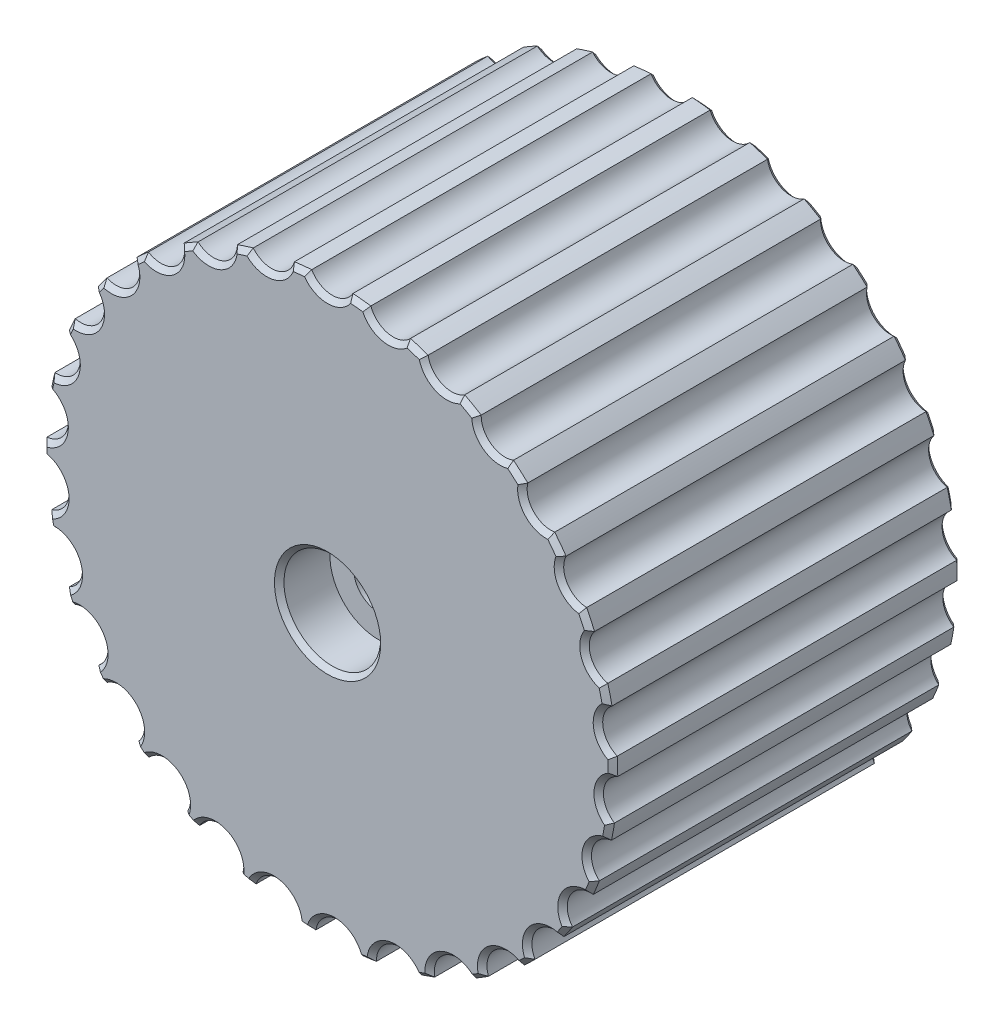
from build123d import *

# Parameters (mm, degrees)
SKIZZE1_R                       = 18
GRUNDK_RPER_DEPTH               = 14
SKIZZE3_R                       = 11.05
SITZ_KUGELLAGER_DEPTH           = 7.5
SITZ_SCHNECKENGEH_USE_START     = 8
SKIZZE4_R                       = 18
SKIZZE4_R_2                     = 15.6
SITZ_SCHNECKENGEH_USE_DEPTH     = 8
SKIZZE5_R                       = 1.55
BOHRUNG_M3_ZAPFEN_DEPTH         = 34.645207683
SKIZZE6_R                       = 3.05
SENKUNG_M3_DEPTH                = 3.2
SKIZZE7_R                       = 1.5
SCHNITT_LINEAR_AUSTRAGEN3_DEPTH = 34.645207683
FASE1_SIZE                      = 0.3
FREISCHNITTKUGELLAGER_DEPTH     = 7.5
FASE2_SIZE                      = 0.4


with BuildPart() as part:
    # Skizze1 → Grundkörper (new body)
    with BuildSketch(Plane.XY):
        Circle(SKIZZE1_R)
    extrude(amount=GRUNDK_RPER_DEPTH)

    # Skizze3 → Sitz_Kugellager (cut)
    with BuildSketch(Plane(origin=(0, 0, 0), x_dir=(-1, 0, 0), z_dir=(0, 0, -1))):
        Circle(SKIZZE3_R)
    extrude(amount=-SITZ_KUGELLAGER_DEPTH, mode=Mode.SUBTRACT)

    # Skizze4 → Sitz_SchneckenGehäuse (add)
    with BuildSketch(Plane(origin=(0, 0, 0), x_dir=(-1, 0, 0), z_dir=(0, 0, -1)).offset(SITZ_SCHNECKENGEH_USE_START)):
        Circle(SKIZZE4_R)
        Circle(SKIZZE4_R_2, mode=Mode.SUBTRACT)
    extrude(amount=-SITZ_SCHNECKENGEH_USE_DEPTH)

    # Skizze5 → Bohrung M3 Zapfen (cut, through all)
    with BuildSketch(Plane.XY.offset(14)):
        Circle(SKIZZE5_R)
    extrude(amount=-BOHRUNG_M3_ZAPFEN_DEPTH, mode=Mode.SUBTRACT)

    # Skizze6 → Senkung M3 (cut)
    with BuildSketch(Plane.XY.offset(14)):
        Circle(SKIZZE6_R)
    extrude(amount=-SENKUNG_M3_DEPTH, mode=Mode.SUBTRACT)

    # Skizze7 → Schnitt-Linear austragen3 (cut, through all)
    with BuildSketch(Plane.XY.offset(14)):
        with Locations((0, 18.7)):
            Circle(SKIZZE7_R)
        with Locations((3.840889693, 18.343624365)):
            Circle(SKIZZE7_R)
        with Locations((7.52375207, 17.196470523)):
            Circle(SKIZZE7_R)
        with Locations((10.887628372, 15.308674601)):
            Circle(SKIZZE7_R)
        with Locations((13.785501065, 12.762742339)):
            Circle(SKIZZE7_R)
        with Locations((16.090719205, 9.669943194)):
            Circle(SKIZZE7_R)
        with Locations((17.702533699, 6.16544733)):
            Circle(SKIZZE7_R)
        with Locations((18.550500518, 2.402418031)):
            Circle(SKIZZE7_R)
        with Locations((18.597559443, -1.454682263)):
            Circle(SKIZZE7_R)
        with Locations((17.841653775, -5.237279763)):
            Circle(SKIZZE7_R)
        with Locations((16.315820216, -8.780056806)):
            Circle(SKIZZE7_R)
        with Locations((14.086745017, -11.928177036)):
            Circle(SKIZZE7_R)
        with Locations((11.251849459, -14.544052492)):
            Circle(SKIZZE7_R)
        with Locations((7.935032082, -16.513356864)):
            Circle(SKIZZE7_R)
        with Locations((4.281253721, -17.750022102)):
            Circle(SKIZZE7_R)
        with Locations((0.450202022, -18.2)):
            Circle(SKIZZE7_R)
        with Locations((-3.390687671, -17.843624365)):
            Circle(SKIZZE7_R)
        with Locations((-7.073550047, -16.696470523)):
            Circle(SKIZZE7_R)
        with Locations((-10.43742635, -14.808674601)):
            Circle(SKIZZE7_R)
        with Locations((-13.335299043, -12.262742339)):
            Circle(SKIZZE7_R)
        with Locations((-15.640517183, -9.169943194)):
            Circle(SKIZZE7_R)
        with Locations((-17.252331677, -5.66544733)):
            Circle(SKIZZE7_R)
        with Locations((-18.100298496, -1.902418031)):
            Circle(SKIZZE7_R)
        with Locations((-18.147357421, 1.954682263)):
            Circle(SKIZZE7_R)
        with Locations((-17.391451752, 5.737279763)):
            Circle(SKIZZE7_R)
        with Locations((-15.865618194, 9.280056806)):
            Circle(SKIZZE7_R)
        with Locations((-13.636542995, 12.428177036)):
            Circle(SKIZZE7_R)
        with Locations((-10.801647437, 15.044052492)):
            Circle(SKIZZE7_R)
        with Locations((-7.48483006, 17.013356864)):
            Circle(SKIZZE7_R)
        with Locations((-3.831051698, 18.250022102)):
            Circle(SKIZZE7_R)
    extrude(amount=-SCHNITT_LINEAR_AUSTRAGEN3_DEPTH, mode=Mode.SUBTRACT)

    # Fase1
    fase1_edges = [part.edges().sort_by_distance(p)[0] for p in [
        (15.6, 0, -8),
        (17.102127152, -1.337711064, -8),
        (17.102127152, -1.337711064, 14),
        (16.402381555, -4.814792511, -8),
        (16.402381555, -4.814792511, 14),
        (14.994931633, -8.069245051, -8),
        (14.994931633, -8.069245051, 14),
        (12.942011218, -10.958855351, -8),
        (12.942011218, -10.958855351, 14),
        (10.33400092, -13.357648657, -8),
        (10.33400092, -13.357648657, 14),
        (7.285361892, -15.16134775, -8),
        (7.285361892, -15.16134775, 14),
        (3.929544005, -16.291838205, -8),
        (3.929544005, -16.291838205, 14),
        (0.413108807, -16.700458706, -8),
        (0.413108807, -16.700458706, 14),
        (-16.608515653, -1.745625337, -8),
        (-16.608515653, -1.745625337, 14),
        (3.533477918, 16.87546293, -8),
        (3.533477918, 16.87546293, 14),
        (6.92250395, 15.822243213, -8),
        (6.92250395, 15.822243213, 14),
        (10.018265281, 14.086296666, -8),
        (10.018265281, 14.086296666, 14),
        (12.684795951, 11.743699527, -8),
        (12.684795951, 11.743699527, 14),
        (14.805026945, 8.897288413, -8),
        (14.805026945, 8.897288413, 14),
        (16.285988352, 5.672092205, -8),
        (16.285988352, 5.672092205, 14),
        (17.062923496, 2.209766525, -8),
        (17.062923496, 2.209766525, 14),
        (-3.110664895, -16.369993731, -8),
        (-3.110664895, -16.369993731, 14),
        (-6.488412449, -15.315306525, -8),
        (-6.488412449, -15.315306525, 14),
        (-12.231166047, -11.247414644, -8),
        (-12.231166047, -11.247414644, 14),
        (-9.573272427, -13.582608535, -8),
        (-9.573272427, -13.582608535, 14),
        (-14.34651947, -8.411279949, -8),
        (-14.34651947, -8.411279949, 14),
        (-15.827206272, -5.197454187, -8),
        (-15.827206272, -5.197454187, 14),
        (-16.655983786, 1.794043911, -8),
        (-16.655983786, 1.794043911, 14),
        (-15.96696249, 5.267353874, -8),
        (-15.96696249, 5.267353874, 14),
        (-6.880792926, 15.640353171, -8),
        (-6.880792926, 15.640353171, 14),
        (-3.05, 0, 14),
        (-9.926795083, 13.825597175, -8),
        (-9.926795083, 13.825597175, 14),
        (-12.527901138, 11.417774526, -8),
        (-12.527901138, 11.417774526, 14),
        (-14.570842726, 8.522721684, -8),
        (-14.570842726, 8.522721684, 14),
        (-3.522887784, 16.782018355, -8),
        (-3.522887784, 16.782018355, 14),
        (0, 17.2, -8),
        (0, 17.2, 14),
        (17.515235554, 4.149279875, 14),
        (16.29626312, 7.644070142, 14),
        (14.391939436, 10.810739071, 14),
        (11.883403688, 13.519789821, 14),
        (8.874728972, 15.660114484, 14),
        (5.489353832, 17.142549242, 14),
        (1.866122968, 17.903004917, 14),
        (-1.845177718, 17.905175765, 14),
        (-5.488897258, 17.142695438, 14),
        (-8.909226545, 15.640514134, 14),
        (-11.956444307, 13.455238368, 14),
        (-14.493504933, 10.674189186, 14),
        (-16.402674498, 7.412979786, 14),
        (-17.591831713, 3.811490124, 14),
        (-17.99997786, 0.028231948, 14),
        (-17.601466242, -3.766747419, 14),
        (-16.408490545, -7.400097164, 14),
        (-14.471474851, -10.704037352, 14),
        (-11.87717883, -13.525258705, 14),
        (-8.74454407, -15.733179876, 14),
        (-5.218527085, -17.226925874, 14),
        (-1.462359108, -17.940499041, 14),
        (2.351181861, -17.845782243, 14),
        (6.048823012, -16.953222118, 14),
        (9.465510145, -15.310261843, 14),
        (12.452201871, -12.997794758, 14),
        (14.882310584, -10.125059589, 14),
        (16.656536218, -6.823474278, 14),
        (17.706015893, -3.239907589, 14),
        (17.993858472, 0.470167311, 14),
        (-17.591831713, 3.811490124, -8),
        (-16.402674498, 7.412979786, -8),
        (-14.493504933, 10.674189186, -8),
        (-11.956444307, 13.455238368, -8),
        (-8.909226545, 15.640514134, -8),
        (-5.488897258, 17.142695438, -8),
        (-1.845177718, 17.905175765, -8),
        (1.866122968, 17.903004917, -8),
        (5.489353832, 17.142549242, -8),
        (8.874728972, 15.660114484, -8),
        (11.883403688, 13.519789821, -8),
        (14.391939436, 10.810739071, -8),
        (16.29626312, 7.644070142, -8),
        (17.515235554, 4.149279875, -8),
        (17.993858472, 0.470167311, -8),
        (17.706015893, -3.239907589, -8),
        (16.656536218, -6.823474278, -8),
        (14.882310584, -10.125059589, -8),
        (12.452201871, -12.997794758, -8),
        (9.465510145, -15.310261843, -8),
        (6.048823012, -16.953222118, -8),
        (2.351181861, -17.845782243, -8),
        (-1.462359108, -17.940499041, -8),
        (-5.218527085, -17.226925874, -8),
        (-8.74454407, -15.733179876, -8),
        (-11.87717883, -13.525258705, -8),
        (-14.471474851, -10.704037352, -8),
        (-16.408490545, -7.400097164, -8),
        (-17.601466242, -3.766747419, -8),
        (-17.99997786, 0.028231948, -8),
    ]]
    chamfer(fase1_edges, length=FASE1_SIZE)

    # Skizze8 → FreischnittKugellager (cut)
    with BuildSketch(Plane(origin=(0, 0, 0), x_dir=(-1, 0, 0), z_dir=(0, 0, -1))):
        with BuildLine():
            Line((4.228651928, 10.208868834), (4.419993644, 10.670808601))
            ThreePointArc((4.419993644, 10.670808601), (0, 11.55), (-4.419993644, 10.670808601))
            Line((-4.419993644, 10.670808601), (-4.228651928, 10.208868834))
            ThreePointArc((-4.228651928, 10.208868834), (-5.525, 9.569580712), (-6.726813791, 8.76655441))
            Line((-6.726813791, 8.76655441), (-7.031194505, 9.16323108))
            ThreePointArc((-7.031194505, 9.16323108), (-10.002593414, 5.775), (-11.451188149, 1.50757752))
            Line((-11.451188149, 1.50757752), (-10.955465718, 1.442314424))
            ThreePointArc((-10.955465718, 1.442314424), (-11.05, 0), (-10.955465718, -1.442314424))
            Line((-10.955465718, -1.442314424), (-11.451188149, -1.50757752))
            ThreePointArc((-11.451188149, -1.50757752), (-10.002593414, -5.775), (-7.031194505, -9.16323108))
            Line((-7.031194505, -9.16323108), (-6.726813791, -8.76655441))
            ThreePointArc((-6.726813791, -8.76655441), (-5.525, -9.569580712), (-4.228651928, -10.208868834))
            Line((-4.228651928, -10.208868834), (-4.419993644, -10.670808601))
            ThreePointArc((-4.419993644, -10.670808601), (0, -11.55), (4.419993644, -10.670808601))
            Line((4.419993644, -10.670808601), (4.228651928, -10.208868834))
            ThreePointArc((4.228651928, -10.208868834), (5.525, -9.569580712), (6.726813791, -8.76655441))
            Line((6.726813791, -8.76655441), (7.031194505, -9.16323108))
            ThreePointArc((7.031194505, -9.16323108), (10.002593414, -5.775), (11.451188149, -1.50757752))
            Line((11.451188149, -1.50757752), (10.955465718, -1.442314424))
            ThreePointArc((10.955465718, -1.442314424), (11.05, 0), (10.955465718, 1.442314424))
            Line((10.955465718, 1.442314424), (11.451188149, 1.50757752))
            ThreePointArc((11.451188149, 1.50757752), (10.002593414, 5.775), (7.031194505, 9.16323108))
            Line((7.031194505, 9.16323108), (6.726813791, 8.76655441))
            ThreePointArc((6.726813791, 8.76655441), (5.525, 9.569580712), (4.228651928, 10.208868834))
        make_face()
    extrude(amount=-FREISCHNITTKUGELLAGER_DEPTH, mode=Mode.SUBTRACT)

    # Fase2
    fase2_edges = [part.edges().sort_by_distance(p)[0] for p in [
        (-5.525, 9.569580712, 0),
        (5.525, 9.569580712, 0),
        (11.05, 0, 0),
        (5.525, -9.569580712, 0),
        (-5.525, -9.569580712, 0),
        (-11.05, 0, 0),
    ]]
    chamfer(fase2_edges, length=FASE2_SIZE)


solid = part.part
